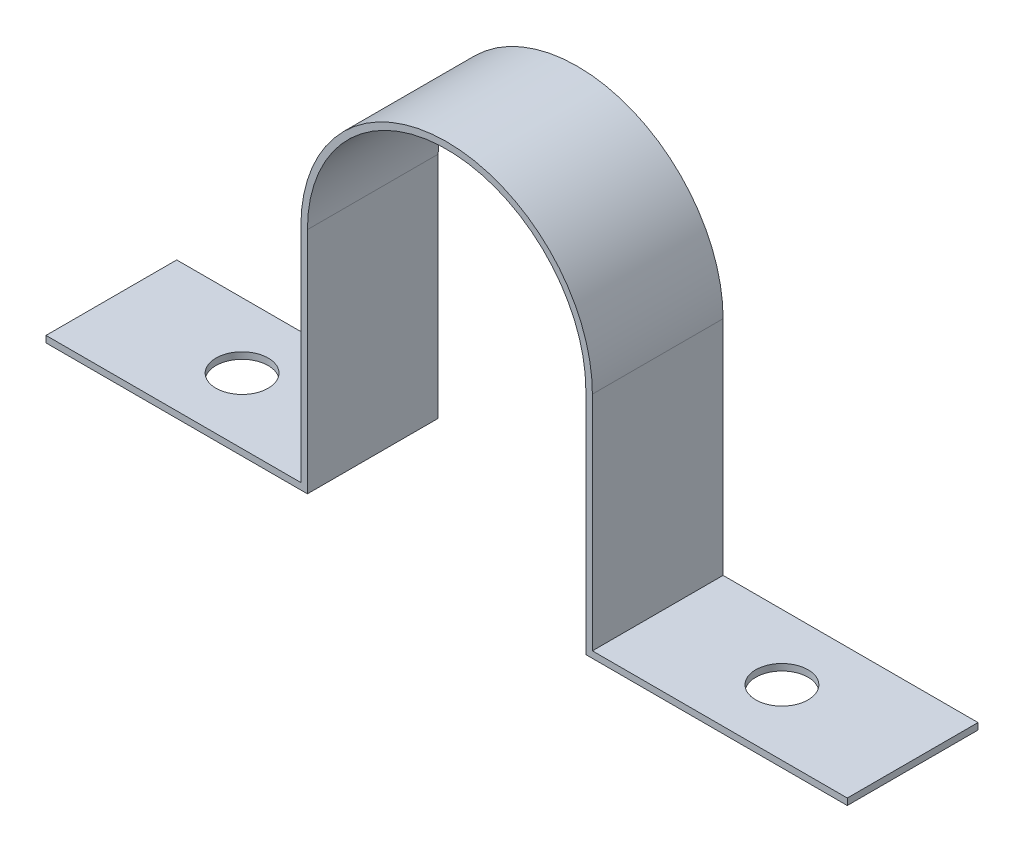
from build123d import *

# Parameters (mm, degrees)
SALIENTE_EXTRUIR1_DEPTH = 10
CROQUIS2_R              = 2
CORTAR_EXTRUIR1_DEPTH   = 10


with BuildPart() as part:
    # Croquis1 → Saliente-Extruir1 (new body)
    with BuildSketch(Plane.XY):
        with BuildLine():
            Line((-11.15, 0), (-11.15, -17.007351352))
            Line((-11.15, -17.007351352), (-30.65, -17.007351352))
            Line((-30.65, -17.007351352), (-30.65, -17.507351352))
            Line((-30.65, -17.507351352), (-10.65, -17.507351352))
            Line((-10.65, -17.507351352), (-10.65, 0))
            ThreePointArc((-10.65, 0), (0, 10.65), (10.65, 0))
            Line((10.65, 0), (10.65, -17.507351352))
            Line((10.65, -17.507351352), (30.65, -17.507351352))
            Line((30.65, -17.507351352), (30.65, -17.007351352))
            Line((30.65, -17.007351352), (11.15, -17.007351352))
            Line((11.15, -17.007351352), (11.15, 0))
            ThreePointArc((11.15, 0), (0, 11.15), (-11.15, 0))
        make_face()
    extrude(amount=SALIENTE_EXTRUIR1_DEPTH)

    # Croquis2 → Cortar-Extruir1 (cut)
    with BuildSketch(Plane(origin=(0, -17.007351352, 0), x_dir=(1, 0, 0), z_dir=(0, 1, 0))):
        with Locations(Location((-20.65, -5, 0), (0, 0, 270))):
            Circle(CROQUIS2_R)
        with Locations(Location((20.65, -5, 0), (0, 0, 180))):
            Circle(CROQUIS2_R)
    extrude(amount=-CORTAR_EXTRUIR1_DEPTH, mode=Mode.SUBTRACT)


solid = part.part
